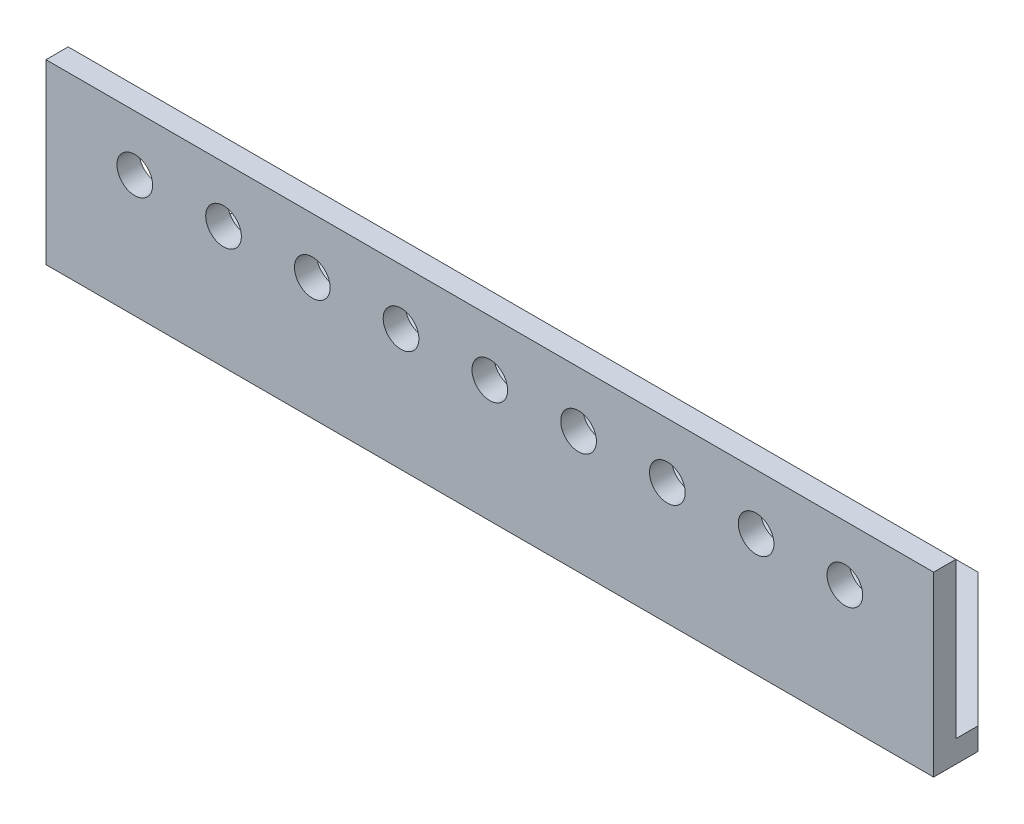
from build123d import *

# Parameters (mm, degrees)
SKETCH2_W           = 127
SKETCH2_H           = 25.4
SKETCH2_R           = 2.5527
BOSS_EXTRUDE1_DEPTH = 3.175
SKETCH4_W           = 127
SKETCH4_H           = 22.225
SKETCH4_R           = 2.5527
BOSS_EXTRUDE3_DEPTH = 3.175
CUT_EXTRUDE1_DEPTH  = 75.392628163


with BuildPart() as part:
    # Sketch2 → Boss-Extrude1 (new body)
    with BuildSketch(Plane(origin=(0, 0, 0), x_dir=(1, 0, 0), z_dir=(0, 1, 0))):
        with Locations((6.35, 0)):
            Rectangle(SKETCH2_W, SKETCH2_H)
        with Locations(Location((0, 0, 0), (0, 0, 270))):
            Circle(SKETCH2_R, mode=Mode.SUBTRACT)
        with Locations(Location((12.7, 0, 0), (0, 0, 270))):
            Circle(SKETCH2_R, mode=Mode.SUBTRACT)
        with Locations(Location((25.4, 0, 0), (0, 0, 270))):
            Circle(SKETCH2_R, mode=Mode.SUBTRACT)
        with Locations(Location((38.1, 0, 0), (0, 0, 270))):
            Circle(SKETCH2_R, mode=Mode.SUBTRACT)
        with Locations(Location((-12.7, 0, 0), (0, 0, 270))):
            Circle(SKETCH2_R, mode=Mode.SUBTRACT)
        with Locations(Location((-25.4, 0, 0), (0, 0, 270))):
            Circle(SKETCH2_R, mode=Mode.SUBTRACT)
        with Locations(Location((-38.1, 0, 0), (0, 0, 270))):
            Circle(SKETCH2_R, mode=Mode.SUBTRACT)
        with Locations(Location((50.8, 0, 0), (0, 0, 270))):
            Circle(SKETCH2_R, mode=Mode.SUBTRACT)
    extrude(amount=BOSS_EXTRUDE1_DEPTH)

    # Sketch4 → Boss-Extrude3 (add)
    with BuildSketch(Plane.XY.offset(12.7)):
        with Locations((6.35, 14.2875)):
            Rectangle(SKETCH4_W, SKETCH4_H)
        with Locations((6.35, 17.4625)):
            Circle(SKETCH4_R, mode=Mode.SUBTRACT)
        with Locations((19.05, 17.4625)):
            Circle(SKETCH4_R, mode=Mode.SUBTRACT)
        with Locations((31.75, 17.4625)):
            Circle(SKETCH4_R, mode=Mode.SUBTRACT)
        with Locations((44.45, 17.4625)):
            Circle(SKETCH4_R, mode=Mode.SUBTRACT)
        with Locations((57.15, 17.4625)):
            Circle(SKETCH4_R, mode=Mode.SUBTRACT)
        with Locations(Location((-44.45, 17.4625, 0), (0, 0, 180))):
            Circle(SKETCH4_R, mode=Mode.SUBTRACT)
        with Locations(Location((-31.75, 17.4625, 0), (0, 0, 180))):
            Circle(SKETCH4_R, mode=Mode.SUBTRACT)
        with Locations(Location((-19.05, 17.4625, 0), (0, 0, 180))):
            Circle(SKETCH4_R, mode=Mode.SUBTRACT)
        with Locations(Location((-6.35, 17.4625, 0), (0, 0, 180))):
            Circle(SKETCH4_R, mode=Mode.SUBTRACT)
    extrude(amount=-BOSS_EXTRUDE3_DEPTH)

    # Sketch5 → Cut-Extrude1 (cut, through all)
    with BuildSketch(Plane(origin=(0, 3.175, 0), x_dir=(1, 0, 0), z_dir=(0, 1, 0))):
        Polygon((-38.1, 12.7), (-57.15, -6.35), (-57.15, 12.7), align=None)
        Polygon((50.8, 12.7), (69.85, -6.35), (69.85, 12.7), align=None)
    extrude(amount=-CUT_EXTRUDE1_DEPTH, mode=Mode.SUBTRACT)


solid = part.part
